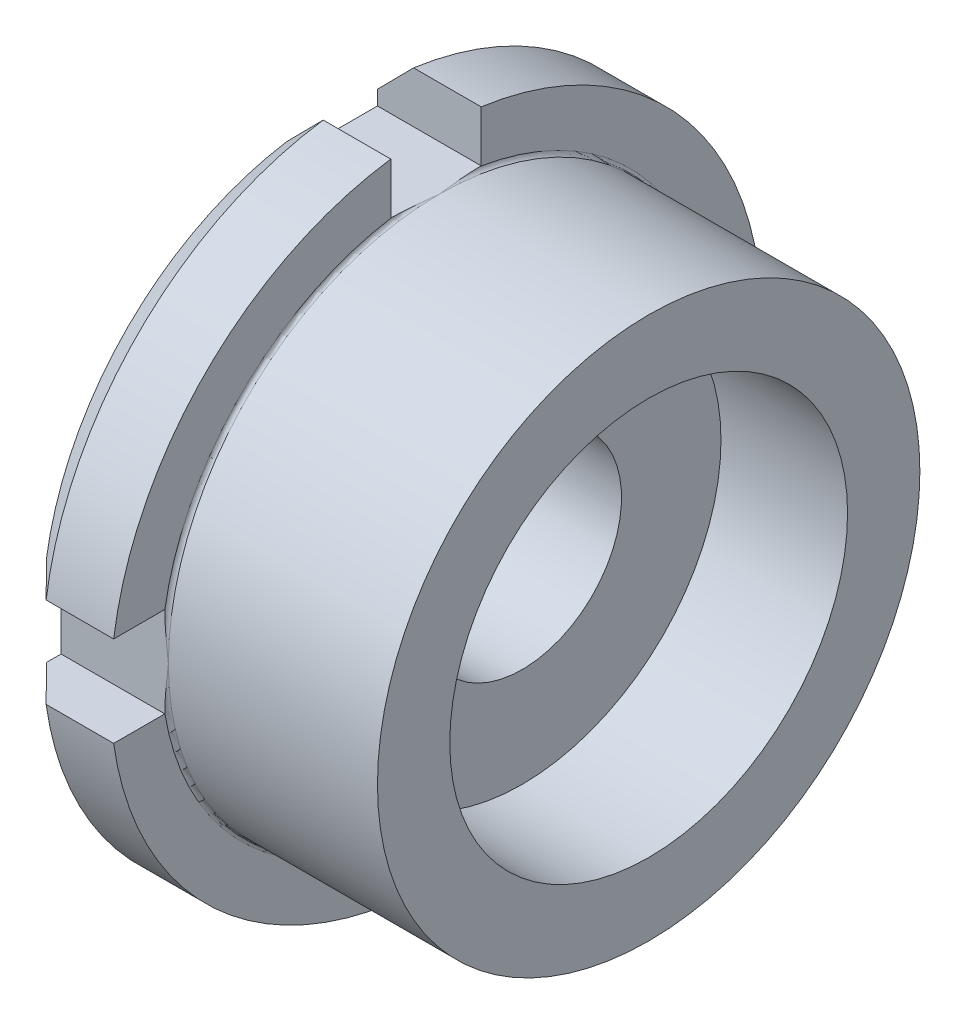
from build123d import *
from build123d.topology import SkipClean

# Parameters (mm, degrees)
SKETCH2_W          = 5
SKETCH2_H          = 3
CUT_EXTRUDE1_DEPTH = 31.890937182
CIRPATTERN3_COUNT  = 4


with BuildPart() as part:
    # Sketch1 → Revolve3 (revolve)
    with BuildSketch(Plane.XY, mode=Mode.PRIVATE) as revolve3_sk:
        with BuildLine():
            Line((5.5, 5.5), (10.5, 5.5))
            Line((10.5, 5.5), (10.5, 11))
            Line((10.5, 11), (17.5, 11))
            Line((17.5, 11), (17.5, 15))
            Line((17.5, 15), (5.935714286, 15))
            ThreePointArc((5.935714286, 15), (5.794292929, 15.058578644), (5.735714286, 15.2))
            Line((5.735714286, 15.2), (5.735714286, 18))
            Line((5.735714286, 18), (2, 18))
            Line((2, 18), (0, 16))
            Line((0, 16), (0, 12))
            ThreePointArc((0, 12), (0.292893219, 11.292893219), (1, 11))
            Line((1, 11), (4.5, 11))
            ThreePointArc((4.5, 11), (5.207106781, 10.707106781), (5.5, 10))
            Line((5.5, 10), (5.5, 5.5))
        make_face()
    revolve(revolve3_sk.sketch.rotate(Axis((0, 0, 0), (1, 0, 0)), 90), axis=Axis((0, 0, 0), (1, 0, 0)))

    # Sketch2 → Cut-Extrude1 (cut, symmetric)
    with SkipClean():  # the faces are left unmerged after this step: merging them gives an invalid solid
        with BuildSketch(Plane.ZY):
            with Locations((0, 16.5)):
                Rectangle(SKETCH2_W, SKETCH2_H)
        cut_extrude1 = extrude(amount=CUT_EXTRUDE1_DEPTH, both=True, mode=Mode.SUBTRACT)

    # CirPattern3: Cut-Extrude1 ×4 about axis
    cirpattern3_axis = Axis((0, 0, 0), (1, 0, 0))
    for i in range(1, CIRPATTERN3_COUNT):
        add(cut_extrude1.rotate(cirpattern3_axis, i * 360 / CIRPATTERN3_COUNT), mode=Mode.SUBTRACT)


solid = part.part
